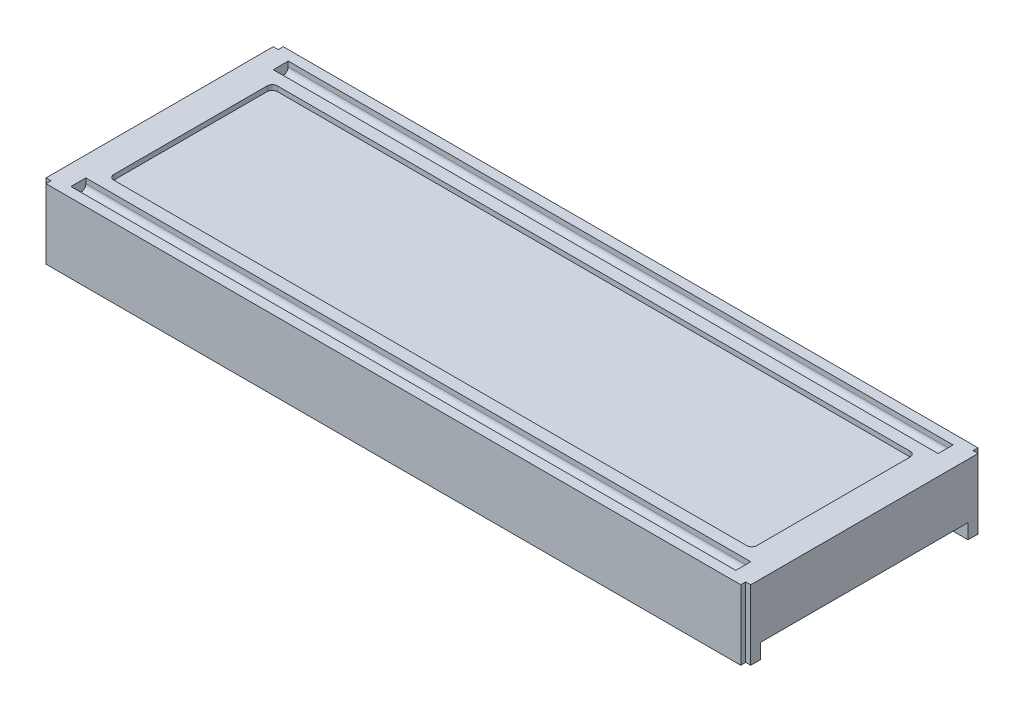
from build123d import *

# Parameters (mm, degrees)
CROQUIS1_W              = 70.7
CROQUIS1_H              = 23.8
SALIENTE_EXTRUIR1_DEPTH = 7
CROQUIS2_W              = 64.5
CROQUIS2_H              = 16.4
CORTAR_EXTRUIR1_DEPTH   = 0.5
REDONDEO1_R             = 0.5
CROQUIS3_W              = 0.5
CROQUIS3_H              = 0.5
CORTAR_EXTRUIR2_DEPTH   = 7
CROQUIS4_W              = 70.7
CROQUIS4_H              = 20.8
CORTAR_EXTRUIR3_DEPTH   = 1.5
CROQUIS5_W              = 66.7
CROQUIS5_H              = 1.5
CORTAR_EXTRUIR4_DEPTH   = 1
REDONDEO2_R             = 0.5


with BuildPart() as part:
    # Croquis1 → Saliente-Extruir1 (new body)
    with BuildSketch(Plane(origin=(0, 0, 0), x_dir=(1, 0, 0), z_dir=(0, 1, 0))):
        Rectangle(CROQUIS1_W, CROQUIS1_H)
    extrude(amount=SALIENTE_EXTRUIR1_DEPTH)

    # Croquis2 → Cortar-Extruir1 (cut)
    with BuildSketch(Plane(origin=(0, 7, 0), x_dir=(1, 0, 0), z_dir=(0, 1, 0))):
        Rectangle(CROQUIS2_W, CROQUIS2_H)
    extrude(amount=-CORTAR_EXTRUIR1_DEPTH, mode=Mode.SUBTRACT)

    # Redondeo1
    redondeo1_edges = [part.edges().sort_by_distance(p)[0] for p in [
        (-32.25, 6.75, 8.2),
        (-32.25, 6.75, -8.2),
        (32.25, 6.75, -8.2),
        (32.25, 6.75, 8.2),
    ]]
    fillet(redondeo1_edges, radius=REDONDEO1_R)

    # Croquis3 → Cortar-Extruir2 (cut)
    with BuildSketch(Plane(origin=(0, 7, 0), x_dir=(1, 0, 0), z_dir=(0, 1, 0))):
        with Locations((-35.1, 11.65)):
            Rectangle(CROQUIS3_W, CROQUIS3_H)
        with Locations((-35.1, -11.65)):
            Rectangle(CROQUIS3_W, CROQUIS3_H)
        with Locations((35.1, -11.65)):
            Rectangle(CROQUIS3_W, CROQUIS3_H)
        with Locations((35.1, 11.65)):
            Rectangle(CROQUIS3_W, CROQUIS3_H)
    extrude(amount=-CORTAR_EXTRUIR2_DEPTH, mode=Mode.SUBTRACT)

    # Croquis4 → Cortar-Extruir3 (cut)
    with BuildSketch(Plane.XZ):
        Rectangle(CROQUIS4_W, CROQUIS4_H)
    extrude(amount=-CORTAR_EXTRUIR3_DEPTH, mode=Mode.SUBTRACT)

    # Croquis5 → Cortar-Extruir4 (cut)
    with BuildSketch(Plane(origin=(0, 7, 0), x_dir=(1, 0, 0), z_dir=(0, 1, 0))):
        with Locations((0, 10.15)):
            Rectangle(CROQUIS5_W, CROQUIS5_H)
        with Locations((0, -10.15)):
            Rectangle(CROQUIS5_W, CROQUIS5_H)
    extrude(amount=-CORTAR_EXTRUIR4_DEPTH, mode=Mode.SUBTRACT)

    # Redondeo2
    redondeo2_edges = [part.edges().sort_by_distance(p)[0] for p in [
        (0, 6, -10.9),
        (0, 6, -9.4),
        (0, 6, 9.4),
        (0, 6, 10.9),
    ]]
    fillet(redondeo2_edges, radius=REDONDEO2_R)


solid = part.part
